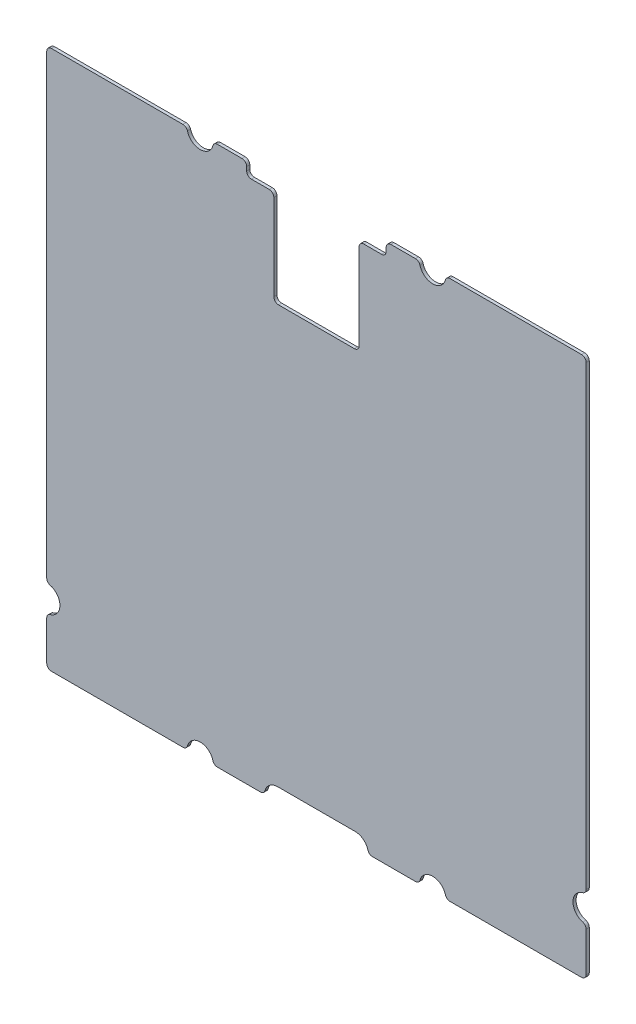
from build123d import *

# Parameters (mm, degrees)
BOSS_EXTRUDE1_DEPTH = 2
FILLET1_R           = 3


with BuildPart() as part:
    # Sketch2 → Boss-Extrude1 (new body)
    with BuildSketch(Plane.XY):
        with BuildLine():
            Line((-25, -165.5), (25, -165.5))
            ThreePointArc((25, -165.5), (31.01040764, -167.98959236), (33.5, -174))
            Line((33.5, -174), (66.5, -174))
            ThreePointArc((66.5, -174), (75, -165.5), (83.5, -174))
            Line((83.5, -174), (174, -174))
            Line((174, -174), (174, -143))
            ThreePointArc((174, -143), (165.5, -134.5), (174, -126))
            Line((174, -126), (174, 174))
            Line((174, 174), (83.5, 174))
            ThreePointArc((83.5, 174), (75, 165.5), (66.5, 174))
            Line((66.5, 174), (45, 174))
            Line((45, 174), (45, 165.5))
            Line((45, 165.5), (27.5, 165.5))
            Line((27.5, 165.5), (27.5, 104))
            Line((27.5, 104), (-27.5, 104))
            Line((-27.5, 104), (-27.5, 165.5))
            Line((-27.5, 165.5), (-45, 165.5))
            Line((-45, 165.5), (-45, 174))
            Line((-45, 174), (-66.5, 174))
            ThreePointArc((-66.5, 174), (-75, 165.5), (-83.5, 174))
            Line((-83.5, 174), (-174, 174))
            Line((-174, 174), (-174, -126))
            ThreePointArc((-174, -126), (-165.5, -134.5), (-174, -143))
            Line((-174, -143), (-174, -174))
            Line((-174, -174), (-83.5, -174))
            ThreePointArc((-83.5, -174), (-75, -165.5), (-66.5, -174))
            Line((-66.5, -174), (-33.5, -174))
            ThreePointArc((-33.5, -174), (-31.01040764, -167.98959236), (-25, -165.5))
        make_face()
    extrude(amount=BOSS_EXTRUDE1_DEPTH)

    # Fillet1
    fillet1_edges = [part.edges().sort_by_distance(p)[0] for p in [
        (174, -174, 1),
        (83.5, -174, 1),
        (66.5, -174, 1),
        (33.5, -174, 1),
        (-33.5, -174, 1),
        (-66.5, -174, 1),
        (-83.5, -174, 1),
        (-174, -174, 1),
        (-174, -143, 1),
        (-174, -126, 1),
        (-174, 174, 1),
        (-83.5, 174, 1),
        (-66.5, 174, 1),
        (-45, 174, 1),
        (-45, 165.5, 1),
        (-27.5, 165.5, 1),
        (-27.5, 104, 1),
        (27.5, 104, 1),
        (27.5, 165.5, 1),
        (45, 165.5, 1),
        (45, 174, 1),
        (66.5, 174, 1),
        (83.5, 174, 1),
        (174, 174, 1),
        (174, -126, 1),
        (174, -143, 1),
    ]]
    fillet(fillet1_edges, radius=FILLET1_R)


solid = part.part
